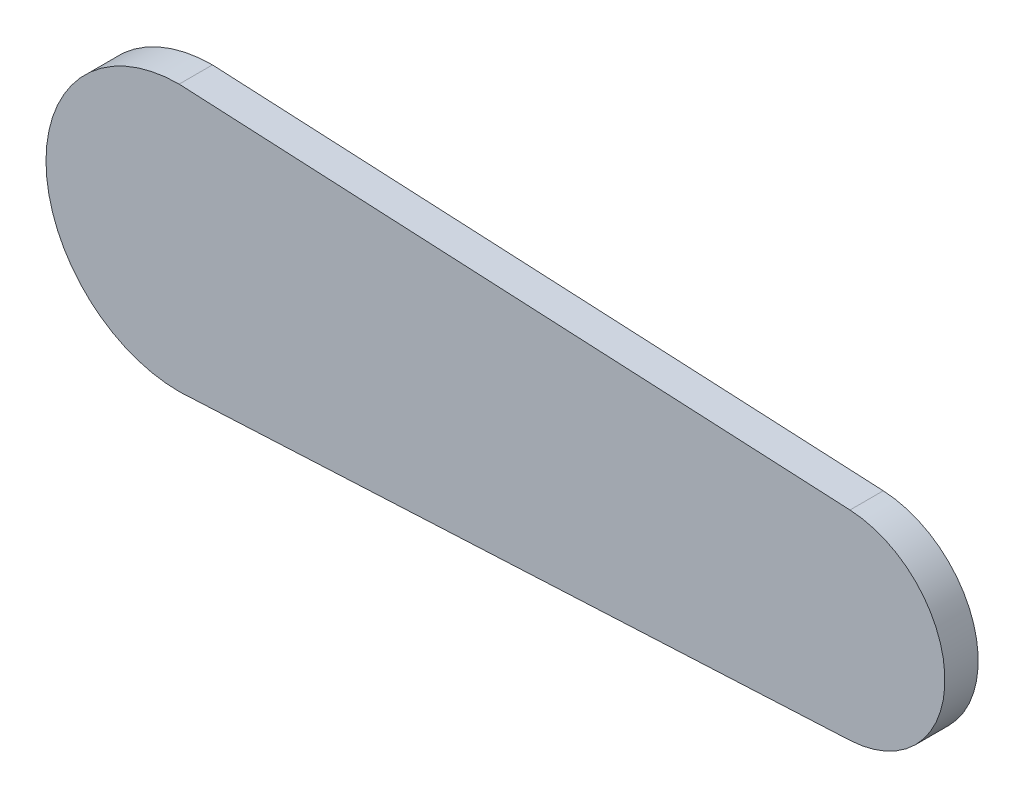
from build123d import *

# Parameters (mm, degrees)
EXTRUDE_1_DEPTH = 10


with BuildPart() as part:
    # 草图1 → 凸台-拉伸1 (new body)
    with BuildSketch(Plane.XY):
        with BuildLine():
            Line((201.49256952, 29.962847599), (0, 40))
            ThreePointArc((0, 40), (-40, 0), (0, -40))
            Line((0, -40), (201.49256952, -29.962847599))
            ThreePointArc((201.49256952, -29.962847599), (230, 0), (201.49256952, 29.962847599))
        make_face()
    extrude(amount=EXTRUDE_1_DEPTH)


solid = part.part
